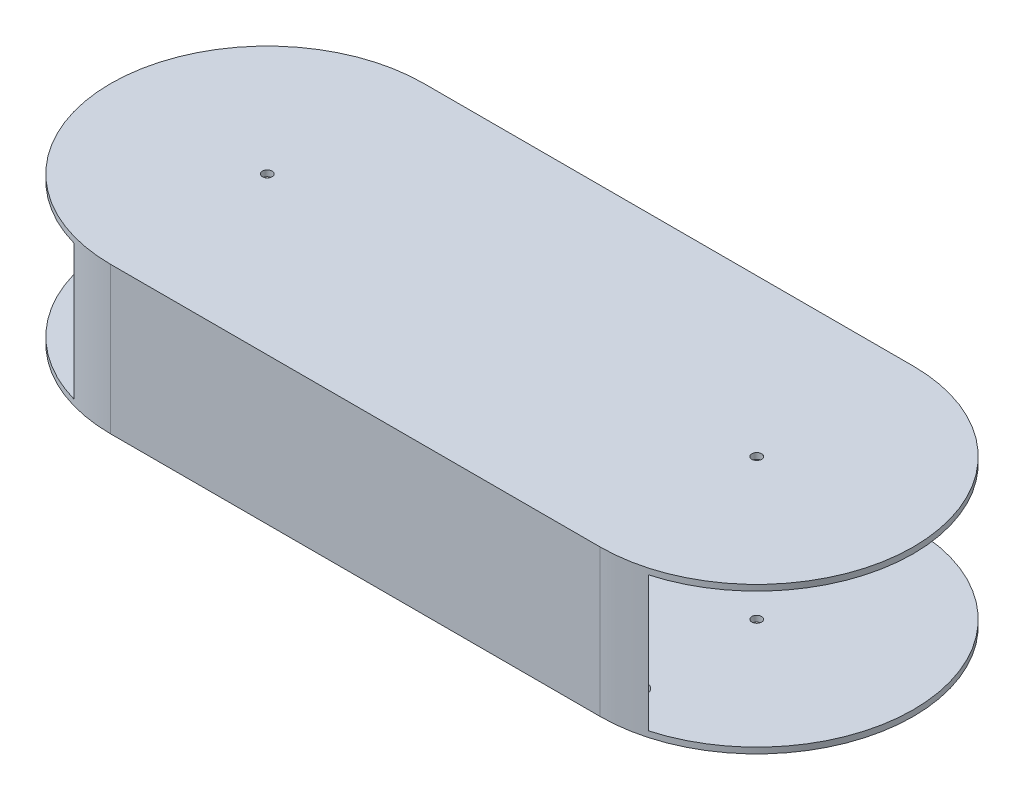
from build123d import *

# Parameters (mm, degrees)
EXTRUDE_1_DEPTH                  = 75
CUT_EXTRUDE_1_DEPTH              = 69
SKETCH_4_W                       = 160
SKETCH_4_H                       = 69
CUT_EXTRUDE_2_DEPTH              = 157
SKETCH_5_R                       = 2.5
CUT_EXTRUDE_3_DEPTH              = 348.108052341
CUT_EXTRUDE_16_REACH             = 349.108
SKETCH_6_R                       = 2.5
CUT_EXTRUDE_18_REACH             = 349.743
SKETCH_8_R                       = 5
CUT_EXTRUDE_19_REACH             = 349.743
SKETCH_9_R                       = 5
CUT_EXTRUDE_20_DEPTH             = 348.742720988
CUT_EXTRUDE_20_DEPTH_BACK        = 348.742720988
SKETCH_10_R                      = 2.5
CUT_EXTRUDE_21_REACH             = 349.743
SKETCH_11_R                      = 5
CUT_EXTRUDE_21_DIRECTION_2_DEPTH = 348.742720988
EXTRUDE_2_DEPTH                  = 69


with BuildPart() as part:
    # 草图1 → 凸台-拉伸1 (new body)
    with BuildSketch(Plane(origin=(0, 0, 0), x_dir=(1, 0, 0), z_dir=(0, 1, 0))):
        with BuildLine():
            Line((0, 80), (250, 80))
            ThreePointArc((250, 80), (330, 0), (250, -80))
            Line((250, -80), (0, -80))
            ThreePointArc((0, -80), (-80, 0), (0, 80))
        make_face()
    extrude(amount=EXTRUDE_1_DEPTH)

    # 草图3 → 切除-拉伸1 (cut)
    with BuildSketch(Plane(origin=(0, 72, 0), x_dir=(1, 0, 0), z_dir=(0, 1, 0))):
        with BuildLine():
            Line((0, 77), (250, 77))
            ThreePointArc((250, 77), (327, 0), (250, -77))
            Line((250, -77), (0, -77))
            ThreePointArc((0, -77), (-77, 0), (0, 77))
        make_face()
    extrude(amount=-CUT_EXTRUDE_1_DEPTH, mode=Mode.SUBTRACT)

    # 草图4 → 切除-拉伸2 (cut)
    with BuildSketch(Plane(origin=(0, 0, -80), x_dir=(-1, 0, 0), z_dir=(0, 0, -1))):
        with Locations((0, 37.5)):
            Rectangle(SKETCH_4_W, SKETCH_4_H)
        with Locations((-250, 37.5)):
            Rectangle(SKETCH_4_W, SKETCH_4_H)
    extrude(amount=-CUT_EXTRUDE_2_DEPTH, mode=Mode.SUBTRACT)

    # 草图5 → 切除-拉伸3 (cut, through all)
    with BuildSketch(Plane(origin=(0, 3, 0), x_dir=(1, 0, 0), z_dir=(0, 1, 0))):
        with Locations(Location((0, 0, 0), (0, 0, 270))):
            Circle(SKETCH_5_R)
    extrude(amount=-CUT_EXTRUDE_3_DEPTH, mode=Mode.SUBTRACT)

    # 草图6 → 切除-拉伸16 (cut, up to next)
    with BuildSketch(Plane(origin=(0, 72, 0), x_dir=(1, 0, 0), z_dir=(0, 1, 0)), mode=Mode.PRIVATE) as cut_extrude_16_sk1:
        with Locations(Location((0, 0, 0), (0, 0, 270))):
            Circle(SKETCH_6_R)
    cut_extrude_16_tool1 = extrude(cut_extrude_16_sk1.sketch, amount=CUT_EXTRUDE_16_REACH, mode=Mode.PRIVATE) & part.part
    add(cut_extrude_16_tool1.solids().sort_by_distance((0, 72, 0))[0], mode=Mode.SUBTRACT)

    # 草图8 → 切除-拉伸18 (cut, up to next)
    with BuildSketch(Plane(origin=(0, 0, 0), x_dir=(-1, 0, 0), z_dir=(0, -1, 0)), mode=Mode.PRIVATE) as cut_extrude_18_sk1:
        with Locations(Location((0, -61.25, 0), (0, 0, 90))):
            Circle(SKETCH_8_R)
    cut_extrude_18_tool1 = extrude(cut_extrude_18_sk1.sketch, amount=-CUT_EXTRUDE_18_REACH, mode=Mode.PRIVATE) & part.part
    add(cut_extrude_18_tool1.solids().sort_by_distance((0, 0, 61.25))[0], mode=Mode.SUBTRACT)

    # 草图9 → 切除-拉伸19 (cut, up to next)
    with BuildSketch(Plane.XZ, mode=Mode.PRIVATE) as cut_extrude_19_sk1:
        with Locations(Location((0, -61.25, 0), (0, 0, 270))):
            Circle(SKETCH_9_R)
    cut_extrude_19_tool1 = extrude(cut_extrude_19_sk1.sketch, amount=-CUT_EXTRUDE_19_REACH, mode=Mode.PRIVATE) & part.part
    add(cut_extrude_19_tool1.solids().sort_by_distance((0, 0, -61.25))[0], mode=Mode.SUBTRACT)

    # 草图10 → 切除-拉伸20 (cut, two sides: drawn at the far end of the back side and taken through both)
    with BuildSketch(Plane(origin=(0, 75, 0), x_dir=(1, 0, 0), z_dir=(0, 1, 0)).offset(-CUT_EXTRUDE_20_DEPTH_BACK)):
        with Locations(Location((250, 0, 0), (0, 0, 270))):
            Circle(SKETCH_10_R)
    extrude(amount=CUT_EXTRUDE_20_DEPTH + CUT_EXTRUDE_20_DEPTH_BACK, mode=Mode.SUBTRACT)

    # 草图11 → 切除-拉伸21 (cut, up to next)
    with BuildSketch(Plane.XZ, mode=Mode.PRIVATE) as cut_extrude_21_sk1:
        with Locations(Location((250, 61.25, 0), (0, 0, 90))):
            Circle(SKETCH_11_R)
    cut_extrude_21_tool1 = extrude(cut_extrude_21_sk1.sketch, amount=-CUT_EXTRUDE_21_REACH, mode=Mode.PRIVATE) & part.part
    # 草图11 → 切除-拉伸21 (cut, up to next)
    with BuildSketch(Plane.XZ, mode=Mode.PRIVATE) as cut_extrude_21_sk2:
        with Locations(Location((250.041254048, -61.25, 0), (0, 0, 90))):
            Circle(SKETCH_11_R)
    cut_extrude_21_tool2 = extrude(cut_extrude_21_sk2.sketch, amount=-CUT_EXTRUDE_21_REACH, mode=Mode.PRIVATE) & part.part
    add(cut_extrude_21_tool1.solids().sort_by_distance((250, 0, 61.25))[0], mode=Mode.SUBTRACT)
    add(cut_extrude_21_tool2.solids().sort_by_distance((250.041254, 0, -61.25))[0], mode=Mode.SUBTRACT)

    # 草图11 → 切除-拉伸21 direction 2 (cut)
    with BuildSketch(Plane.XZ):
        with Locations(Location((250, 61.25, 0), (0, 0, 90))):
            Circle(SKETCH_11_R)
        with Locations(Location((250.041254048, -61.25, 0), (0, 0, 90))):
            Circle(SKETCH_11_R)
    extrude(amount=CUT_EXTRUDE_21_DIRECTION_2_DEPTH, mode=Mode.SUBTRACT)

    # 草图12 → 凸台-拉伸2 (add)
    with BuildSketch(Plane(origin=(0, 72, 0), x_dir=(1, 0, 0), z_dir=(0, 1, 0))):
        Polygon((84.732642754, 80), (116.111672897, -2.332361516), (88.187612247, -80), (102.698484118, -80), (123.448818124, -21.583577713), (145.712854307, -80), (156.94150516, -80), (128.865571981, -6.33431085), (159.53273228, 80), (145.712854307, 80), (121.562315366, 12.827988338), (95.961293606, 80), align=None)
    extrude(amount=-EXTRUDE_2_DEPTH)


solid = part.part
